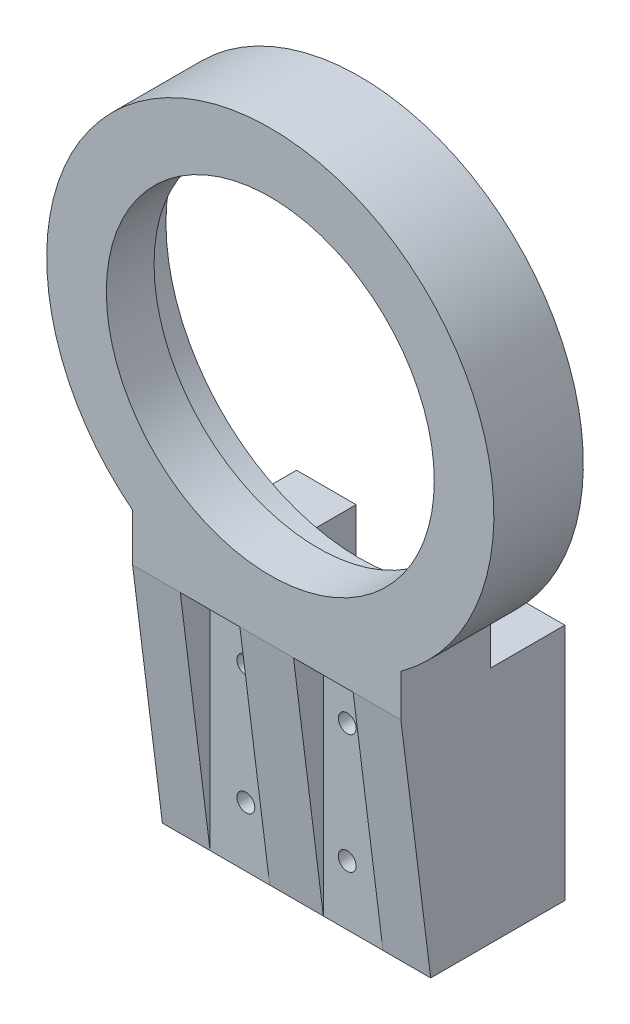
from build123d import *

# Parameters (mm, degrees)
SKETCH1_R           = 27.5
BOSS_EXTRUDE1_DEPTH = 15
SKETCH2_R           = 32.5
SKETCH2_R_2         = 27.5
CUT_EXTRUDE1_DEPTH  = 7
SKETCH3_W           = 5
SKETCH3_H           = 40
CUT_EXTRUDE2_DEPTH  = 45
BOSS_EXTRUDE2_DEPTH = 45
SKETCH6_W           = 10
SKETCH6_H           = 40
CUT_EXTRUDE3_DEPTH  = 5
SKETCH7_W           = 10
SKETCH7_H           = 40
BOSS_EXTRUDE3_DEPTH = 12.5
SKETCH8_R           = 1.5
CUT_EXTRUDE4_DEPTH  = 10


with BuildPart() as part:
    # Sketch1 → Boss-Extrude1 (new body)
    with BuildSketch(Plane.XY):
        with BuildLine():
            Line((-23.101603537, -29.5392267), (-23.101603537, -77.5))
            Line((-23.101603537, -77.5), (21.898396463, -77.5))
            Line((21.898396463, -77.5), (21.898396463, -30.441915714))
            ThreePointArc((21.898396463, -30.441915714), (0.752089542, 37.492457392), (-23.101603537, -29.5392267))
        make_face()
        Circle(SKETCH1_R, mode=Mode.SUBTRACT)
    extrude(amount=BOSS_EXTRUDE1_DEPTH)

    # Sketch2 → Cut-Extrude1 (cut)
    with BuildSketch(Plane(origin=(0, 0, 0), x_dir=(-1, 0, 0), z_dir=(0, 0, -1))):
        Circle(SKETCH2_R)
        Circle(SKETCH2_R_2, mode=Mode.SUBTRACT)
    extrude(amount=-CUT_EXTRUDE1_DEPTH, mode=Mode.SUBTRACT)

    # Sketch3 → Cut-Extrude2 (cut)
    with BuildSketch(Plane(origin=(21.898396463, 0, 0), x_dir=(0, 0, -1), z_dir=(1, 0, 0))):
        with Locations((-12.5, -57.5)):
            Rectangle(SKETCH3_W, SKETCH3_H)
    extrude(amount=-CUT_EXTRUDE2_DEPTH, mode=Mode.SUBTRACT)

    # Sketch5 → Boss-Extrude2 (add)
    with BuildSketch(Plane.ZY.offset(23.101603537)):
        Polygon((10, -37.5), (15, -37.5), (10, -77.5), align=None)
    extrude(amount=-BOSS_EXTRUDE2_DEPTH)

    # Sketch6 → Cut-Extrude3 (cut)
    with BuildSketch(Plane.XY.offset(15)):
        with Locations((-10.101603537, -57.5)):
            Rectangle(SKETCH6_W, SKETCH6_H)
        with Locations((8.898396463, -57.5)):
            Rectangle(SKETCH6_W, SKETCH6_H)
    extrude(amount=-CUT_EXTRUDE3_DEPTH, mode=Mode.SUBTRACT)

    # Sketch7 → Boss-Extrude3 (add)
    with BuildSketch(Plane(origin=(0, 0, 0), x_dir=(-1, 0, 0), z_dir=(0, 0, -1))):
        with Locations((-16.898396463, -57.5)):
            Rectangle(SKETCH7_W, SKETCH7_H)
        with Locations((18.101603537, -57.5)):
            Rectangle(SKETCH7_W, SKETCH7_H)
    extrude(amount=BOSS_EXTRUDE3_DEPTH)

    # Sketch8 → Cut-Extrude4 (cut)
    with BuildSketch(Plane.XY.offset(10)):
        with Locations((-9.101603537, -47.5)):
            Circle(SKETCH8_R)
        with Locations((-9.101603537, -67.5)):
            Circle(SKETCH8_R)
        with Locations((7.898396463, -67.5)):
            Circle(SKETCH8_R)
        with Locations((7.898396463, -47.5)):
            Circle(SKETCH8_R)
    extrude(amount=-CUT_EXTRUDE4_DEPTH, mode=Mode.SUBTRACT)


solid = part.part
